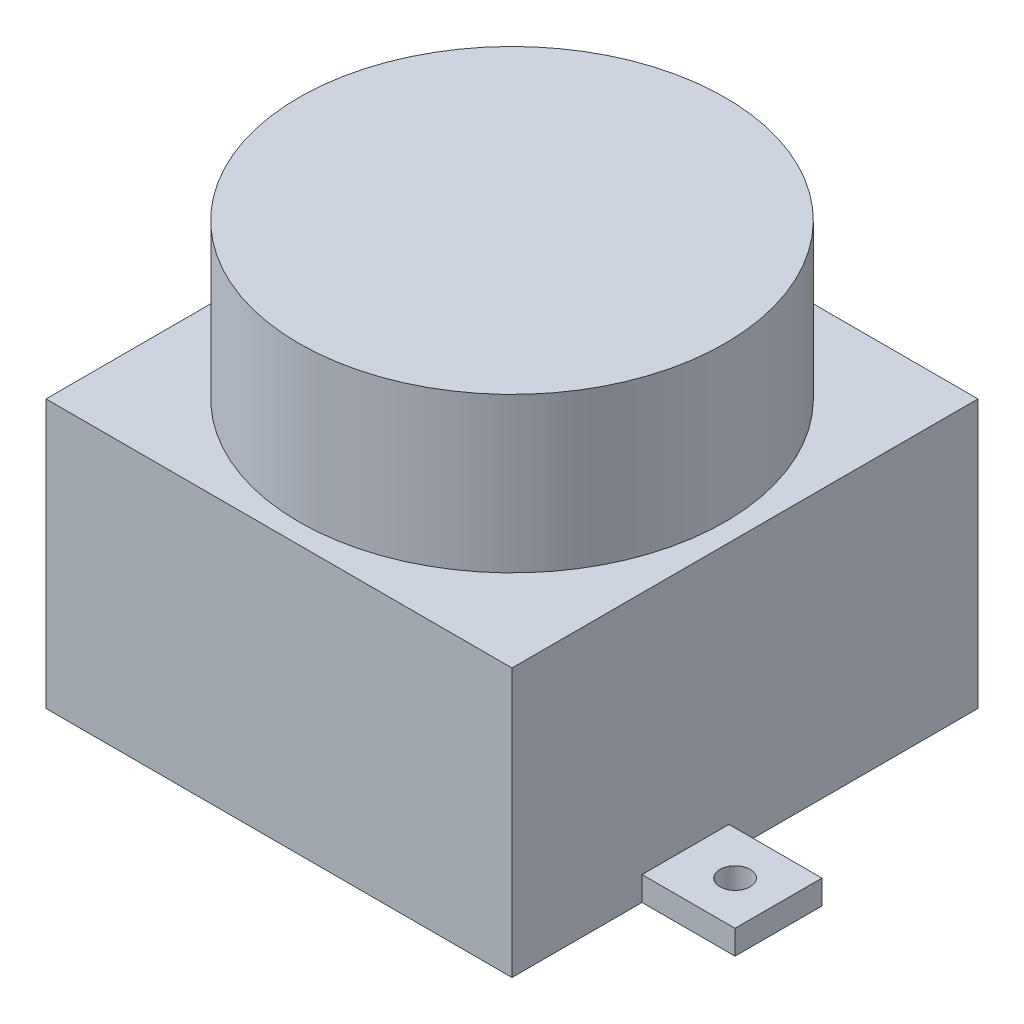
from build123d import *

# Parameters (mm, degrees)
SK_HOUSING_W       = 38.59
SK_HOUSING_H       = 38.59
EX_HOUSING_DEPTH   = 22.2
SK_EARS_W          = 8
SK_EARS_H          = 7.2
SK_EARS_W_2        = 7.2
SK_EARS_H_2        = 8
EX_EARS_DEPTH      = 2
SK_HOLES_3X_R      = 1.25
CUT_HOLES_3X_DEPTH = 2
SK_DOME_R          = 17.645
EX_DOME_DEPTH      = 12.8


with BuildPart() as part:
    # SK_Housing → EX_Housing (new body)
    with BuildSketch(Plane(origin=(0, 0, 0), x_dir=(1, 0, 0), z_dir=(0, 1, 0))):
        Rectangle(SK_HOUSING_W, SK_HOUSING_H)
    extrude(amount=EX_HOUSING_DEPTH)

    # SK_Ears → EX_Ears (add)
    with BuildSketch(Plane(origin=(0, 0, 0), x_dir=(1, 0, 0), z_dir=(0, 1, 0))):
        with Locations((23, -4.93)):
            Rectangle(SK_EARS_W, SK_EARS_H)
        with Locations((-23, -4.93)):
            Rectangle(SK_EARS_W, SK_EARS_H)
        with Locations((0, 23)):
            Rectangle(SK_EARS_W_2, SK_EARS_H_2)
    extrude(amount=EX_EARS_DEPTH)

    # SK_Holes_3x → CUT_Holes_3x (cut)
    with BuildSketch(Plane(origin=(0, 0, 0), x_dir=(1, 0, 0), z_dir=(0, 1, 0))):
        with Locations((23.4, -4.93)):
            Circle(SK_HOLES_3X_R)
        with Locations((-23.4, -4.93)):
            Circle(SK_HOLES_3X_R)
        with Locations((0, 23.39)):
            Circle(SK_HOLES_3X_R)
    extrude(amount=CUT_HOLES_3X_DEPTH, mode=Mode.SUBTRACT)

    # SK_Dome → EX_Dome (add)
    with BuildSketch(Plane(origin=(0, 22.2, 0), x_dir=(1, 0, 0), z_dir=(0, 1, 0))):
        Circle(SK_DOME_R)
    extrude(amount=EX_DOME_DEPTH)


solid = part.part
